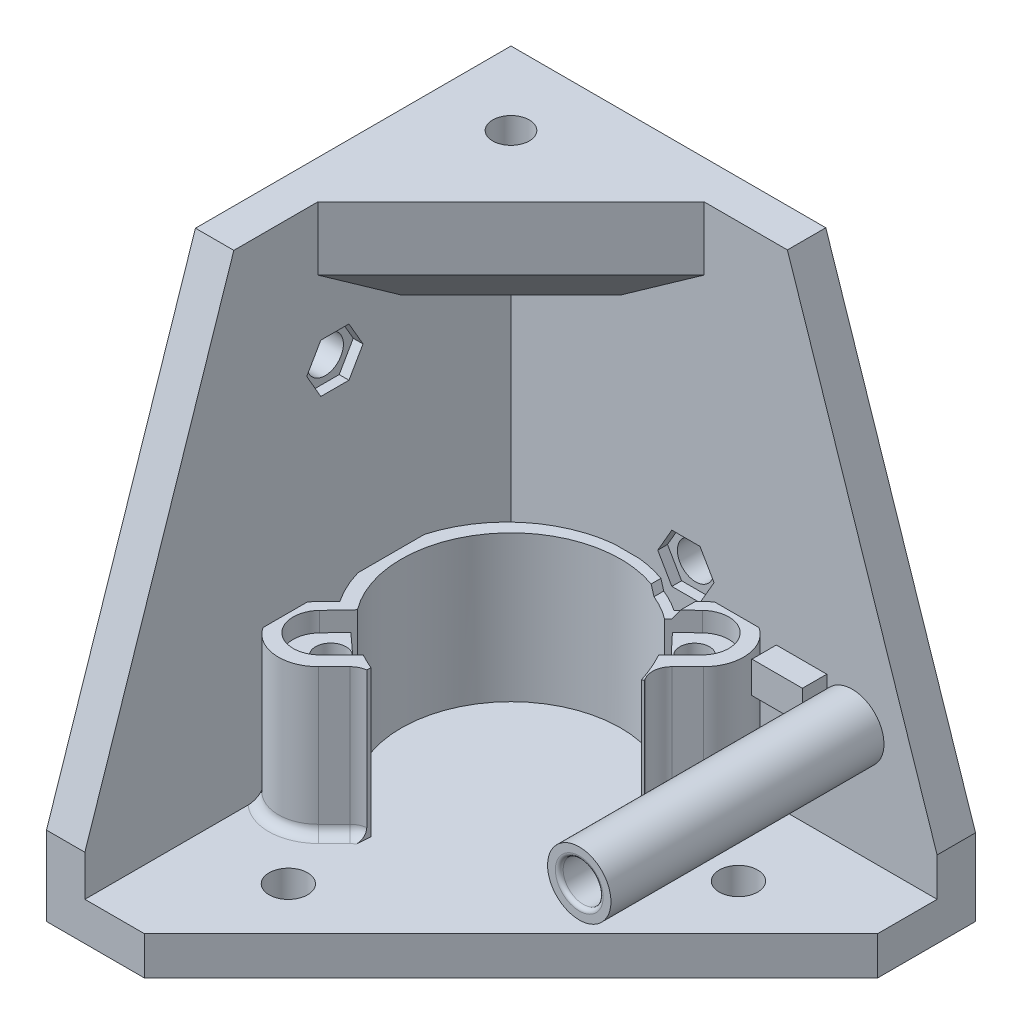
from build123d import *

# Parameters (mm, degrees)
BOSS_EXTRUDE1_DEPTH     = 5
BOSS_EXTRUDE2_DEPTH     = 5
BOSS_EXTRUDE3_DEPTH     = 5
SKETCH6_R               = 2.5
CUT_EXTRUDE1_DEPTH      = 107.549284371
SKETCH9_R               = 4.1275
SKETCH9_R_2             = 2.6035
BOSS_EXTRUDE5_DEPTH     = 35.56
FILLET1_R               = 0.508
BOSS_EXTRUDE6_DEPTH     = 19.05
SKETCH15_R              = 2.38125
BOSS_EXTRUDE7_DEPTH     = 15.875
CHAMFER2_SIZE           = 7.62
FILLET2_R               = 1.27
SKETCH16_W              = 7.844007501
SKETCH16_H              = 4.112882263
BOSS_EXTRUDE8_DEPTH     = 3.175
CHAMFER3_SIZE           = 1.27
SKETCH17_R              = 1.984375
SKETCH17_R_2            = 1.9288125
BOSS_EXTRUDE9_DEPTH     = 16.51
CUT_EXTRUDE2_REACH      = 111.603
SKETCH18_R              = 2.38125
CUT_EXTRUDE3_REACH      = 111.603
SKETCH19_R              = 2.38125
CUT_EXTRUDE4_DEPTH      = 4.13271
CUT_EXTRUDE4_DEPTH_BACK = 1.27
CUT_EXTRUDE5_DEPTH      = 1.27


with BuildPart() as part:
    # Sketch1 → Boss-Extrude1 (new body)
    with BuildSketch(Plane(origin=(0, 0, 0), x_dir=(1, 0, 0), z_dir=(0, 1, 0))):
        Polygon((0, 0), (0, 60.5), (60.5, 60.5), (60.5, 47.75), (12.75, 0), align=None)
    extrude(amount=BOSS_EXTRUDE1_DEPTH)

    # Sketch4 → Boss-Extrude2 (add)
    with BuildSketch(Plane.ZY):
        Polygon((-60.5, 5), (-60.5, 68.5), (-19.4, 68.5), (0, 10.308629506), (0, 5), align=None)
    extrude(amount=-BOSS_EXTRUDE2_DEPTH)

    # Sketch5 → Boss-Extrude3 (add)
    with BuildSketch(Plane(origin=(0, 0, -60.5), x_dir=(-1, 0, 0), z_dir=(0, 0, -1))):
        Polygon((-5, 5), (-5, 68.5), (-41, 68.5), (-60.5, 10.004653177), (-60.5, 5), align=None)
    extrude(amount=-BOSS_EXTRUDE3_DEPTH)

    # Sketch6 → Cut-Extrude1 (cut, through all)
    with BuildSketch(Plane(origin=(0, 5, 0), x_dir=(1, 0, 0), z_dir=(0, 1, 0))):
        with Locations(Location((16.5, 15, 0), (0, 0, 270))):
            Circle(SKETCH6_R)
        with Locations(Location((45.5, 44.625, 0), (0, 0, 270))):
            Circle(SKETCH6_R)
    extrude(amount=-CUT_EXTRUDE1_DEPTH, mode=Mode.SUBTRACT)

    # Sketch9 → Boss-Extrude5 (add)
    with BuildSketch(Plane.XY.offset(-55.5)):
        with Locations(Location((49.45, 19.0462, 0), (0, 0, 180))):
            Circle(SKETCH9_R)
        with Locations(Location((49.45, 19.0462, 0), (0, 0, 180))):
            Circle(SKETCH9_R_2, mode=Mode.SUBTRACT)
    extrude(amount=BOSS_EXTRUDE5_DEPTH)

    # Fillet1
    fillet1_edges = [part.edges().sort_by_distance(p)[0] for p in [
        (52.0535, 19.0462, -19.94),
    ]]
    fillet(fillet1_edges, radius=FILLET1_R)

    # Sketch14 → Boss-Extrude6 (add)
    with BuildSketch(Plane(origin=(0, 5, 0), x_dir=(1, 0, 0), z_dir=(0, 1, 0))):
        with BuildLine():
            Line((6.722962691, 28.802730135), (9.132707699, 31.364136576))
            ThreePointArc((9.132707699, 31.364136576), (10.457950503, 50.042049497), (29.135863424, 51.367292301))
            Line((29.135863424, 51.367292301), (31.697269865, 53.777037309))
            ThreePointArc((31.697269865, 53.777037309), (36.686417723, 53.662894944), (36.648367319, 48.672586637))
            Line((36.648367319, 48.672586637), (33.860208422, 45.884427741))
            ThreePointArc((33.860208422, 45.884427741), (34.790141211, 43.96666613), (35.539002262, 41.971223395))
            Line((35.539002262, 41.971223395), (35.799607225, 42.077391474))
            Line((35.799607225, 42.077391474), (35.633459083, 42.367636838))
            ThreePointArc((35.633459083, 42.367636838), (35.320181387, 43.965693178), (36.041784088, 45.425561844))
            Line((36.041784088, 45.425561844), (38.110219678, 47.493997435))
            ThreePointArc((38.110219678, 47.493997435), (38.110219678, 54.843851927), (30.760365187, 54.843851927))
            Line((30.760365187, 54.843851927), (28.830026438, 52.913513178))
            ThreePointArc((28.830026438, 52.913513178), (8.980759009, 50.993661336), (7.060907167, 31.144393908))
            Line((7.060907167, 31.144393908), (5.656148073, 29.739634813))
            ThreePointArc((5.656148073, 29.739634813), (5.656148073, 22.389780322), (13.006002565, 22.389780322))
            Line((13.006002565, 22.389780322), (15.074438156, 24.458215912))
            ThreePointArc((15.074438156, 24.458215912), (15.744974902, 24.939184047), (16.534306822, 25.179818613))
            Line((16.534306822, 25.179818613), (16.568898656, 25.694636548))
            ThreePointArc((16.568898656, 25.694636548), (15.581109404, 26.144220149), (14.615572259, 26.639791578))
            Line((14.615572259, 26.639791578), (11.827413363, 23.851632681))
            ThreePointArc((11.827413363, 23.851632681), (6.837105056, 23.813582277), (6.722962691, 28.802730135))
        make_face()
    extrude(amount=BOSS_EXTRUDE6_DEPTH)

    # Sketch15 → Boss-Extrude7 (add)
    with BuildSketch(Plane(origin=(0, 68.5, 0), x_dir=(1, 0, 0), z_dir=(0, 1, 0))):
        Polygon((5, 55.5), (5, 30.3375), (30.1625, 55.5), align=None)
        with Locations(Location((9.525, 50.975, 0), (0, 0, 270))):
            Circle(SKETCH15_R, mode=Mode.SUBTRACT)
    extrude(amount=-BOSS_EXTRUDE7_DEPTH)

    # Chamfer2
    chamfer2_edges = [part.edges().sort_by_distance(p)[0] for p in [
        (17.58125, 52.625, -42.91875),
    ]]
    chamfer(chamfer2_edges, length=CHAMFER2_SIZE)

    # Fillet2
    fillet2_edges = [part.edges().sort_by_distance(p)[0] for p in [
        (15.744974902, 5, -24.939184047),
        (14.04022036, 5, -23.423998117),
        (8.812852099, 5, -20.893477035),
        (35.320181387, 5, -43.965693178),
        (35.716533154, 5, -42.222514156),
        (37.076001883, 5, -46.45977964),
        (39.606522965, 5, -51.687147901),
    ]]
    fillet(fillet2_edges, radius=FILLET2_R)

    # Sketch16 → Boss-Extrude8 (add)
    with BuildSketch(Plane.XY.offset(-55.5)):
        with Locations((42.208447341, 21.154254949)):
            Rectangle(SKETCH16_W, SKETCH16_H)
    extrude(amount=BOSS_EXTRUDE8_DEPTH)

    # Chamfer3
    chamfer3_edges = [part.edges().sort_by_distance(p)[0] for p in [
        (38.28644359, 23.21069608, -55.07937031),
    ]]
    chamfer(chamfer3_edges, length=CHAMFER3_SIZE)

    # Sketch17 → Boss-Extrude9 (add)
    # profile 1 of 2: a face of its own
    with BuildSketch(Plane(origin=(0, 5, 0), x_dir=(1, 0, 0), z_dir=(0, 1, 0))):
        with BuildLine():
            Line((14.046968971, 26.071188289), (8.715956726, 30.921156666))
            Line((8.715956726, 30.921156666), (6.722962691, 28.802730135))
            ThreePointArc((6.722962691, 28.802730135), (6.837105056, 23.813582277), (11.827413363, 23.851632681))
            Line((11.827413363, 23.851632681), (14.046968971, 26.071188289))
        make_face()
        with Locations(Location((10.020377911, 27.007841876, 0), (0, 0, 90))):
            Circle(SKETCH17_R, mode=Mode.SUBTRACT)
    # profile 2 of 2: a face of its own
    with BuildSketch(Plane(origin=(0, 5, 0), x_dir=(1, 0, 0), z_dir=(0, 1, 0))):
        with BuildLine():
            Line((31.697269865, 53.777037309), (29.66316707, 51.863374183))
            Line((29.66316707, 51.863374183), (34.595934869, 46.620154187))
            Line((34.595934869, 46.620154187), (36.648367319, 48.672586637))
            ThreePointArc((36.648367319, 48.672586637), (36.686417723, 53.662894944), (31.697269865, 53.777037309))
        make_face()
        with Locations(Location((33.690847255, 50.732351927, 0), (0, 0, 90))):
            Circle(SKETCH17_R_2, mode=Mode.SUBTRACT)
    extrude(amount=BOSS_EXTRUDE9_DEPTH)

    # Sketch18 → Cut-Extrude2 (cut, up to next)
    with BuildSketch(Plane.ZY, mode=Mode.PRIVATE) as cut_extrude2_sk1:
        with Locations((-32.56, 49.53)):
            Circle(SKETCH18_R)
    cut_extrude2_tool1 = extrude(cut_extrude2_sk1.sketch, amount=-CUT_EXTRUDE2_REACH, mode=Mode.PRIVATE) & part.part
    add(cut_extrude2_tool1.solids().sort_by_distance((0, 49.53, -32.56))[0], mode=Mode.SUBTRACT)

    # Sketch19 → Cut-Extrude3 (cut, up to next)
    with BuildSketch(Plane(origin=(0, 0, -60.5), x_dir=(-1, 0, 0), z_dir=(0, 0, -1)), mode=Mode.PRIVATE) as cut_extrude3_sk1:
        with Locations((-27.78125, 26.19375)):
            Circle(SKETCH19_R)
    cut_extrude3_tool1 = extrude(cut_extrude3_sk1.sketch, amount=-CUT_EXTRUDE3_REACH, mode=Mode.PRIVATE) & part.part
    add(cut_extrude3_tool1.solids().sort_by_distance((27.78125, 26.19375, -60.5))[0], mode=Mode.SUBTRACT)

    # Sketch20 → Cut-Extrude4 (cut, two sides: drawn at the far end of the back side and taken through both)
    with BuildSketch(Plane.XY.offset(-55.5).offset(-CUT_EXTRUDE4_DEPTH_BACK)):
        Polygon((31.447424209, 26.19375), (29.614337105, 29.36875), (25.948162895, 29.36875), (24.115075791, 26.19375), (25.948162895, 23.01875), (29.614337105, 23.01875), align=None)
    extrude(amount=CUT_EXTRUDE4_DEPTH + CUT_EXTRUDE4_DEPTH_BACK, mode=Mode.SUBTRACT)

    # Sketch21 → Cut-Extrude5 (cut)
    with BuildSketch(Plane(origin=(5, 0, 0), x_dir=(0, 0, -1), z_dir=(1, 0, 0))):
        Polygon((34.393087105, 52.705), (30.726912895, 52.705), (28.893825791, 49.53), (30.726912895, 46.355), (34.393087105, 46.355), (36.226174209, 49.53), align=None)
    extrude(amount=-CUT_EXTRUDE5_DEPTH, mode=Mode.SUBTRACT)


solid = part.part
